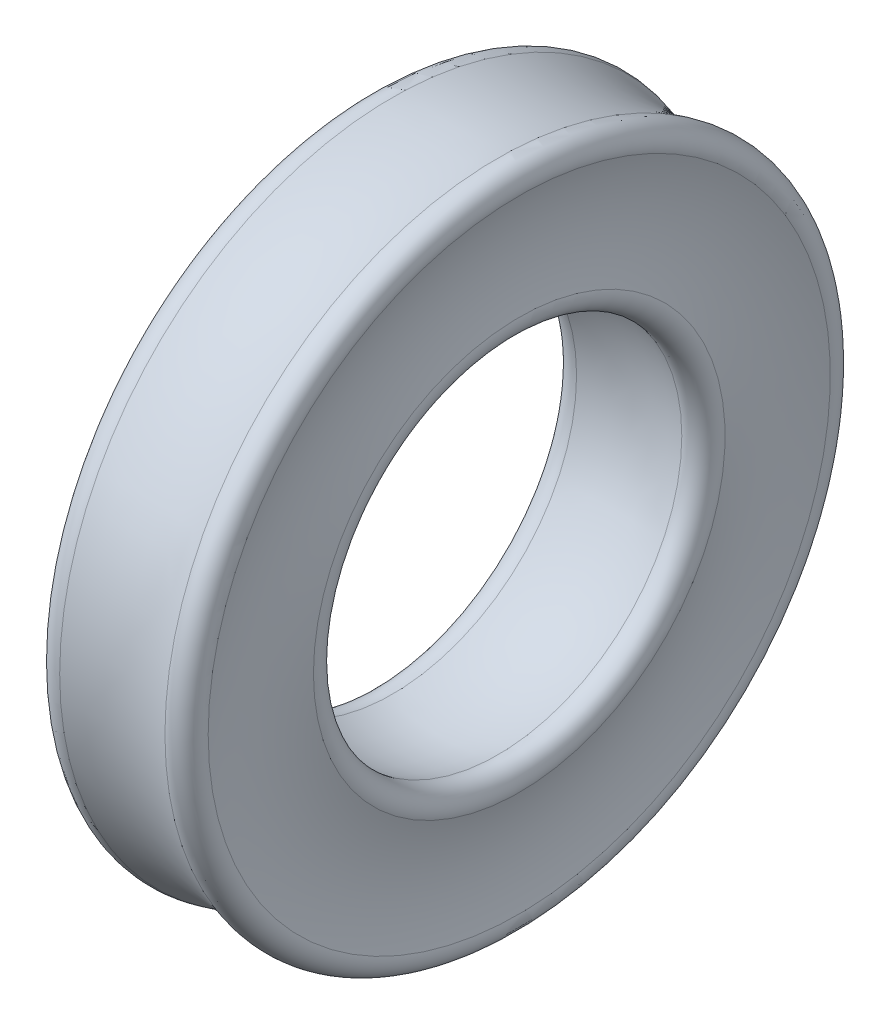
from build123d import *


with BuildPart() as part:
    # 草图1 → 旋转1 (revolve)
    with BuildSketch(Plane.XY, mode=Mode.PRIVATE) as revolve_1_sk:
        with BuildLine():
            ThreePointArc((-0.918181818, 5.805603609), (-1.222132034, 5.732132034), (-1.295603609, 5.428181818))
            ThreePointArc((-1.295603609, 5.428181818), (-1.151639699, 4.51), (-1.295603609, 3.591818182))
            ThreePointArc((-1.295603609, 3.591818182), (-1.222132034, 3.287867966), (-0.918181818, 3.214396391))
            ThreePointArc((-0.918181818, 3.214396391), (0, 3.358360301), (0.918181818, 3.214396391))
            ThreePointArc((0.918181818, 3.214396391), (1.222132034, 3.287867966), (1.295603609, 3.591818182))
            ThreePointArc((1.295603609, 3.591818182), (1.151639699, 4.51), (1.295603609, 5.428181818))
            ThreePointArc((1.295603609, 5.428181818), (1.222132034, 5.732132034), (0.918181818, 5.805603609))
            ThreePointArc((0.918181818, 5.805603609), (0, 5.661639699), (-0.918181818, 5.805603609))
        make_face()
    revolve(revolve_1_sk.sketch.rotate(Axis((0, 0, 0), (1, 0, 0)), 90), axis=Axis((0, 0, 0), (1, 0, 0)))


solid = part.part
